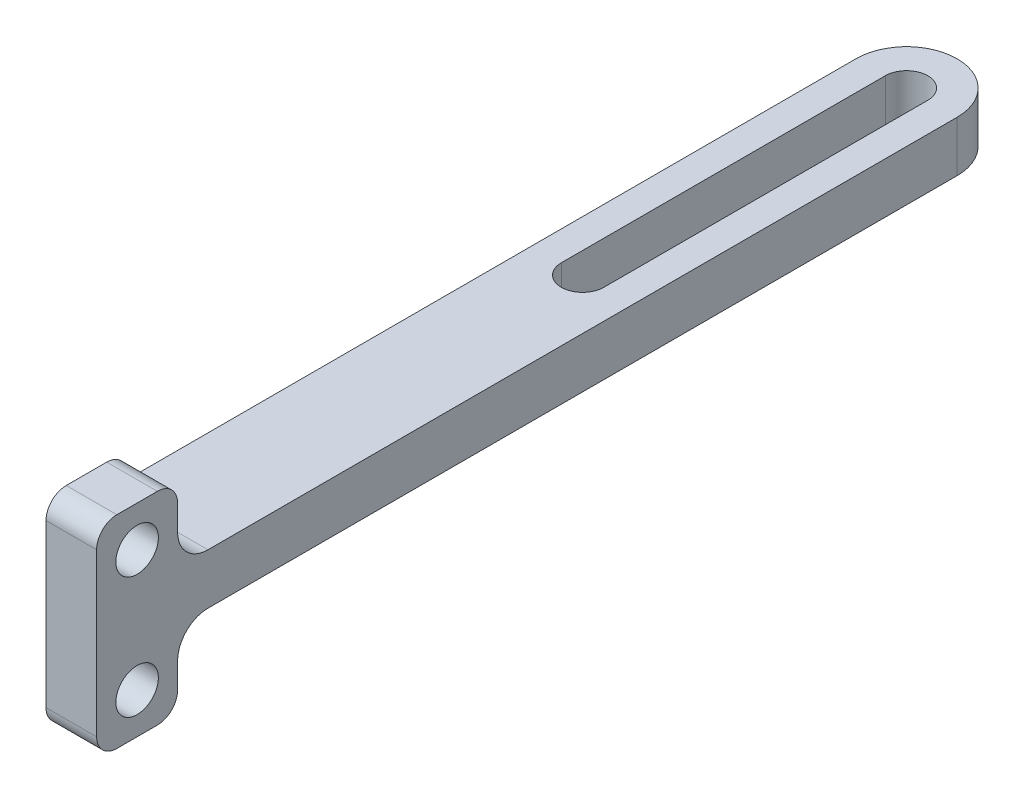
from build123d import *

# Parameters (mm, degrees)
BOSS_EXTRUDE1_DEPTH = 5
SKETCH2_W           = 5
SKETCH2_H           = 20
BOSS_EXTRUDE2_DEPTH = 8
SKETCH3_R           = 2.1
CUT_EXTRUDE1_DEPTH  = 8
FILLET2_R           = 2
SKETCH4_W           = 5
SKETCH4_H           = 5
CUT_EXTRUDE2_DEPTH  = 3
FILLET3_R           = 3


with BuildPart() as part:
    # Sketch1 → Boss-Extrude1 (new body)
    with BuildSketch(Plane(origin=(0, 0, 0), x_dir=(1, 0, 0), z_dir=(0, 1, 0))):
        with BuildLine():
            Line((5, 32), (5, 0))
            Line((5, 0), (5, -45))
            Line((5, -45), (-5, -45))
            Line((-5, -45), (-5, 0))
            Line((-5, 0), (-5, 32))
            ThreePointArc((-5, 32), (0, 37), (5, 32))
        make_face()
        with BuildLine():
            Line((2.1, 32), (2.1, 0))
            ThreePointArc((2.1, 0), (0, -2.1), (-2.1, 0))
            Line((-2.1, 0), (-2.1, 32))
            ThreePointArc((-2.1, 32), (0, 34.1), (2.1, 32))
        make_face(mode=Mode.SUBTRACT)
    extrude(amount=BOSS_EXTRUDE1_DEPTH)

    # Sketch2 → Boss-Extrude2 (add)
    with BuildSketch(Plane.XY.offset(45)):
        with Locations((2.5, 2.5)):
            Rectangle(SKETCH2_W, SKETCH2_H)
    extrude(amount=BOSS_EXTRUDE2_DEPTH)

    # Sketch3 → Cut-Extrude1 (cut)
    with BuildSketch(Plane(origin=(5, 0, 0), x_dir=(0, 0, -1), z_dir=(1, 0, 0))):
        with Locations((-49, 8.5)):
            Circle(SKETCH3_R)
        with Locations((-49, -3.5)):
            Circle(SKETCH3_R)
    extrude(amount=-CUT_EXTRUDE1_DEPTH, mode=Mode.SUBTRACT)

    # Fillet2
    fillet2_edges = [part.edges().sort_by_distance(p)[0] for p in [
        (2.5, 12.5, 45),
        (2.5, -7.5, 45),
        (2.5, 12.5, 53),
        (2.5, -7.5, 53),
    ]]
    fillet(fillet2_edges, radius=FILLET2_R)

    # Sketch4 → Cut-Extrude2 (cut)
    with BuildSketch(Plane.XY.offset(45)):
        with Locations((-2.5, 2.5)):
            Rectangle(SKETCH4_W, SKETCH4_H)
    extrude(amount=-CUT_EXTRUDE2_DEPTH, mode=Mode.SUBTRACT)

    # Fillet3
    fillet3_edges = [part.edges().sort_by_distance(p)[0] for p in [
        (2.5, 0, 45),
        (-5, 2.5, 42),
        (2.5, 5, 45),
    ]]
    fillet(fillet3_edges, radius=FILLET3_R)


solid = part.part
